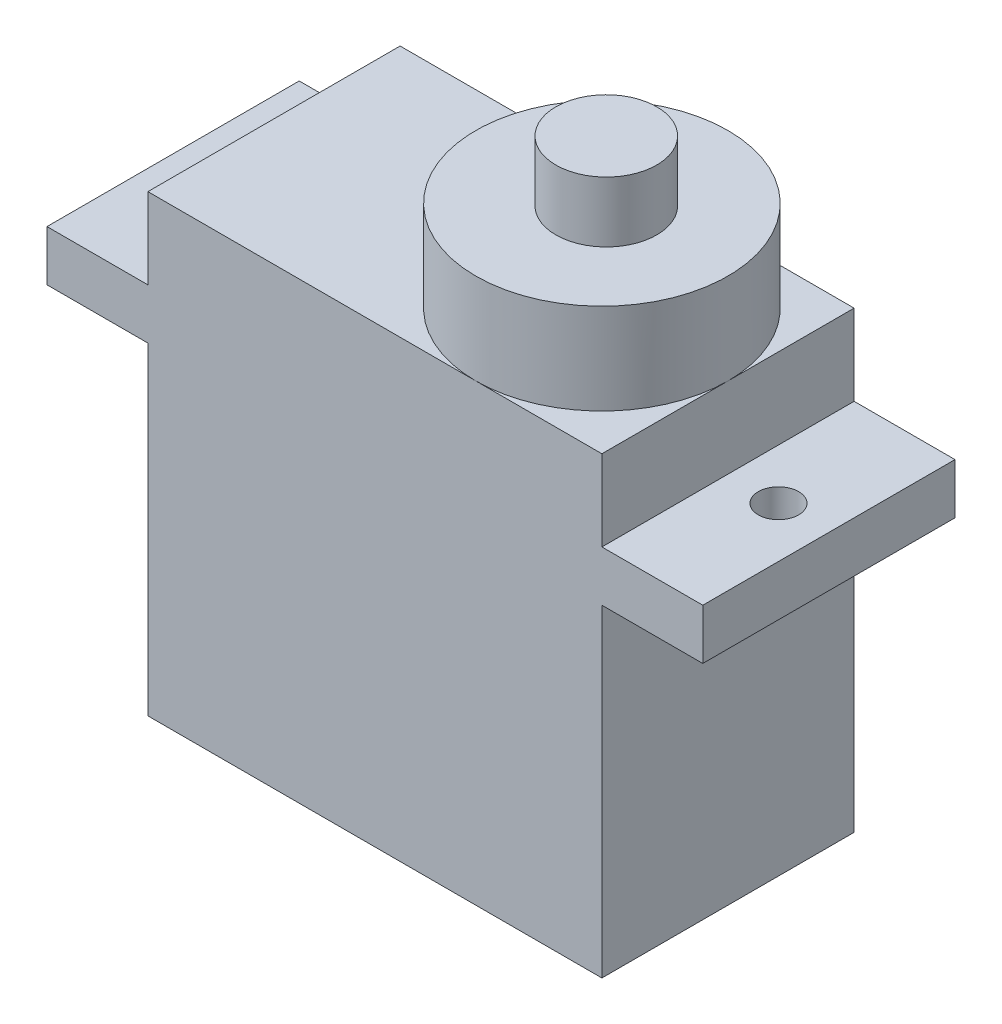
from build123d import *

# Parameters (mm, degrees)
CROQUIS1_W              = 22.5
CROQUIS1_H              = 12.5
SALIENTE_EXTRUIR1_DEPTH = 22.5
CROQUIS2_W              = 5
CROQUIS2_H              = 2.5
SALIENTE_EXTRUIR2_DEPTH = 12.5
CORTAR_EXTRUIR1_REACH   = 27.404
CROQUIS3_R              = 1
CROQUIS4_R              = 6.25
SALIENTE_EXTRUIR3_DEPTH = 4.5
CROQUIS5_R              = 2.5
SALIENTE_EXTRUIR4_DEPTH = 3


with BuildPart() as part:
    # Croquis1 → Saliente-Extruir1 (new body)
    with BuildSketch(Plane(origin=(0, 0, 0), x_dir=(1, 0, 0), z_dir=(0, 1, 0))):
        Rectangle(CROQUIS1_W, CROQUIS1_H)
    extrude(amount=SALIENTE_EXTRUIR1_DEPTH)

    # Croquis2 → Saliente-Extruir2 (add)
    with BuildSketch(Plane.XY.offset(6.25)):
        with Locations((13.75, 17.25)):
            Rectangle(CROQUIS2_W, CROQUIS2_H)
        with Locations((-13.75, 17.25)):
            Rectangle(CROQUIS2_W, CROQUIS2_H)
    extrude(amount=-SALIENTE_EXTRUIR2_DEPTH)

    # Croquis3 → Cortar-Extruir1 (cut, up to next)
    with BuildSketch(Plane(origin=(0, 18.5, 0), x_dir=(1, 0, 0), z_dir=(0, 1, 0)), mode=Mode.PRIVATE) as cortar_extruir1_sk1:
        with Locations(Location((13.75, 0, 0), (0, 0, 270))):
            Circle(CROQUIS3_R)
    cortar_extruir1_tool1 = extrude(cortar_extruir1_sk1.sketch, amount=-CORTAR_EXTRUIR1_REACH, mode=Mode.PRIVATE) & part.part
    # Croquis3 → Cortar-Extruir1 (cut, up to next)
    with BuildSketch(Plane(origin=(0, 18.5, 0), x_dir=(1, 0, 0), z_dir=(0, 1, 0)), mode=Mode.PRIVATE) as cortar_extruir1_sk2:
        with Locations(Location((-13.75, 0, 0), (0, 0, 270))):
            Circle(CROQUIS3_R)
    cortar_extruir1_tool2 = extrude(cortar_extruir1_sk2.sketch, amount=-CORTAR_EXTRUIR1_REACH, mode=Mode.PRIVATE) & part.part
    add(cortar_extruir1_tool1.solids().sort_by_distance((13.75, 18.5, 0))[0], mode=Mode.SUBTRACT)
    add(cortar_extruir1_tool2.solids().sort_by_distance((-13.75, 18.5, 0))[0], mode=Mode.SUBTRACT)

    # Croquis4 → Saliente-Extruir3 (add)
    with BuildSketch(Plane(origin=(0, 22.5, 0), x_dir=(1, 0, 0), z_dir=(0, 1, 0))):
        with Locations(Location((5, 0, 0), (0, 0, 270))):
            Circle(CROQUIS4_R)
    extrude(amount=SALIENTE_EXTRUIR3_DEPTH)

    # Croquis5 → Saliente-Extruir4 (add)
    with BuildSketch(Plane(origin=(0, 27, 0), x_dir=(1, 0, 0), z_dir=(0, 1, 0))):
        with Locations(Location((5.218378147, 0, 0), (0, 0, 270))):
            Circle(CROQUIS5_R)
    extrude(amount=SALIENTE_EXTRUIR4_DEPTH)


solid = part.part
